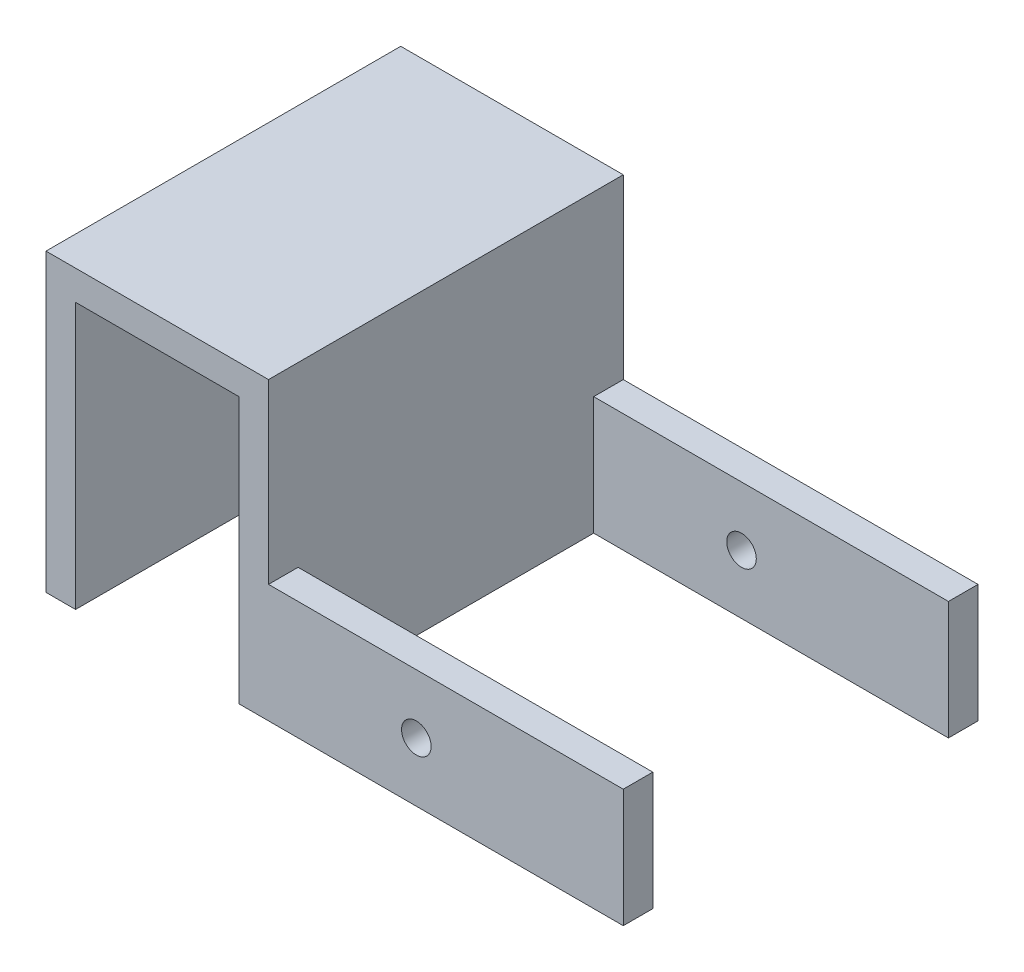
from build123d import *

# Parameters (mm, degrees)
BOSS_EXTRUDE1_DEPTH = 30
SKETCH3_W           = 60
SKETCH3_H           = 5
BOSS_EXTRUDE2_DEPTH = 20
SKETCH4_R           = 2.5
CUT_EXTRUDE1_DEPTH  = 126.034273701


with BuildPart() as part:
    # Sketch1 → Boss-Extrude1 (new, symmetric)
    with BuildSketch(Plane.XY):
        Polygon((0, 0), (0, 50), (37.64, 50), (37.64, 0), (32.64, 0), (32.64, 45), (5, 45), (5, 0), align=None)
    extrude(amount=BOSS_EXTRUDE1_DEPTH, both=True)

    # Sketch3 → Boss-Extrude2 (add)
    with BuildSketch(Plane.XZ):
        with Locations((67.64, 27.5)):
            Rectangle(SKETCH3_W, SKETCH3_H)
        with Locations((67.64, -27.5)):
            Rectangle(SKETCH3_W, SKETCH3_H)
    extrude(amount=-BOSS_EXTRUDE2_DEPTH)

    # Sketch4 → Cut-Extrude1 (cut, through all)
    with BuildSketch(Plane.XY.offset(30)):
        with Locations((62.64, 10)):
            Circle(SKETCH4_R)
    extrude(amount=-CUT_EXTRUDE1_DEPTH, mode=Mode.SUBTRACT)


solid = part.part
